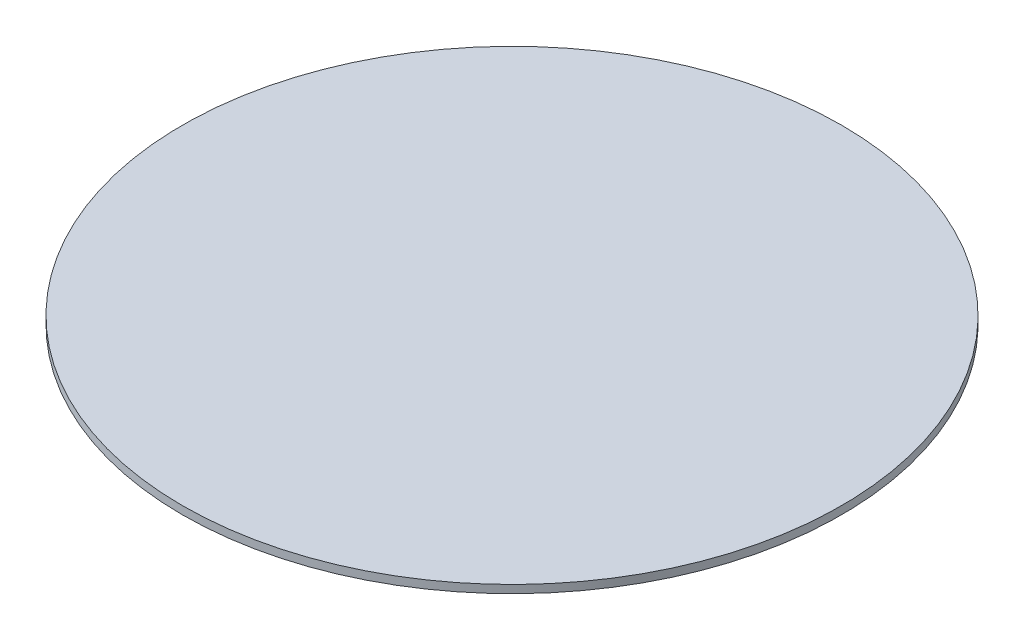
from build123d import *

# Parameters (mm, degrees)
SKETCH1_R           = 206.317165824
BOSS_EXTRUDE1_DEPTH = 5


with BuildPart() as part:
    # Sketch1 → Boss-Extrude1 (new body)
    with BuildSketch(Plane(origin=(0, 0, 0), x_dir=(1, 0, 0), z_dir=(0, 1, 0))):
        with Locations(Location((0, 0, 0), (0, 0, 270))):
            Circle(SKETCH1_R)
    extrude(amount=BOSS_EXTRUDE1_DEPTH)


solid = part.part
